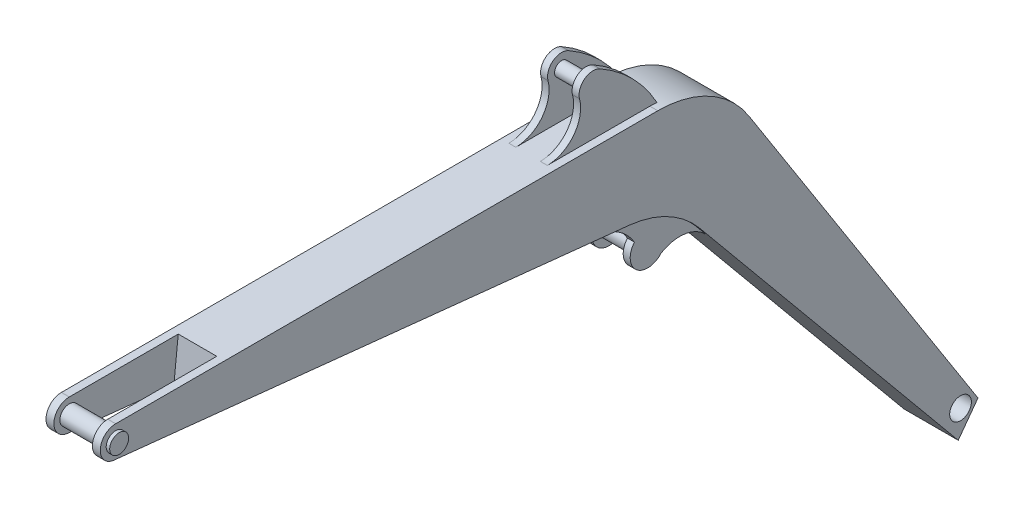
from build123d import *

# Parameters (mm, degrees)
SKETCH1_R           = 31
BOSS_EXTRUDE1_DEPTH = 77.5
CUT_EXTRUDE1_DEPTH  = 55
SKETCH3_R           = 27
BOSS_EXTRUDE2_DEPTH = 87.5
BOSS_EXTRUDE3_START = 55
SKETCH4_R           = 20
BOSS_EXTRUDE3_DEPTH = 20
BOSS_EXTRUDE4_START = 65
SKETCH5_R           = 28
BOSS_EXTRUDE4_DEPTH = 20
SKETCH6_R           = 20
BOSS_EXTRUDE5_DEPTH = 55
SKETCH7_R           = 28
BOSS_EXTRUDE6_DEPTH = 65


with BuildPart() as part:
    # Sketch1 → Boss-Extrude1 (new, symmetric)
    with BuildSketch(Plane(origin=(0, 0, 0), x_dir=(0, 0, -1), z_dir=(1, 0, 0))):
        with BuildLine():
            Line((-1649, 128.575159042), (-100.623018779, 128.575159042))
            ThreePointArc((-100.623018779, 128.575159042), (47.370818148, 90.689624097), (158.95669611, -13.646761532))
            Line((158.95669611, -13.646761532), (813.901849353, -1039.177258296))
            Line((813.901849353, -1039.177258296), (757.478946429, -1115.606676884))
            Line((757.478946429, -1115.606676884), (18.502038696, -221.191618301))
            ThreePointArc((18.502038696, -221.191618301), (-70.923814933, -147.926895035), (-181.413689889, -113.916742069))
            Line((-181.413689889, -113.916742069), (-1653.599252384, 40.816195646))
            ThreePointArc((-1653.599252384, 40.816195646), (-1692.939699529, 86.877941117), (-1649, 128.575159042))
        make_face()
        with Locations((764, -1039.424840958)):
            Circle(SKETCH1_R, mode=Mode.SUBTRACT)
    extrude(amount=BOSS_EXTRUDE1_DEPTH, both=True)

    # Sketch2 → Cut-Extrude1 (cut, symmetric)
    with BuildSketch(Plane(origin=(0, 0, 0), x_dir=(0, 0, -1), z_dir=(1, 0, 0))):
        with BuildLine():
            Line((-1337.780808047, 128.575159042), (-1350.221049377, 8.929861623))
            Line((-1350.221049377, 8.929861623), (-1653.599252384, 40.816195646))
            ThreePointArc((-1653.599252384, 40.816195646), (-1692.939699529, 86.877941117), (-1649, 128.575159042))
            Line((-1649, 128.575159042), (-1337.780808047, 128.575159042))
        make_face()
    extrude(amount=CUT_EXTRUDE1_DEPTH, both=True, mode=Mode.SUBTRACT)

    # Sketch3 → Boss-Extrude2 (add, symmetric)
    with BuildSketch(Plane(origin=(0, 0, 0), x_dir=(0, 0, -1), z_dir=(1, 0, 0))):
        with Locations((-1649, 84.575159042)):
            Circle(SKETCH3_R)
    extrude(amount=BOSS_EXTRUDE2_DEPTH, both=True)

    # Sketch4 → Boss-Extrude3 (add)
    with BuildSketch(Plane(origin=(0, 0, 0), x_dir=(0, 0, -1), z_dir=(1, 0, 0)).offset(BOSS_EXTRUDE3_START)):
        with BuildLine():
            Line((-100.623018779, 128.575159042), (-393.648383075, 128.575159042))
            ThreePointArc((-393.648383075, 128.575159042), (-318.488676572, 165.471643499), (-301.710632022, 247.501084968))
            ThreePointArc((-301.710632022, 247.501084968), (-287.401961188, 289.269705737), (-243.363225881, 292.423359888))
            ThreePointArc((-243.363225881, 292.423359888), (-150.511724148, 221.544648068), (-80.648383075, 127.926771904))
            ThreePointArc((-80.648383075, 127.926771904), (-90.630440565, 128.41301958), (-100.623018779, 128.575159042))
        make_face()
        with Locations((-263, 257.575159042)):
            Circle(SKETCH4_R, mode=Mode.SUBTRACT)
    extrude(amount=-BOSS_EXTRUDE3_DEPTH)

    # Mirror1: part across plane


with BuildPart() as part_1:
    add(part.part)
    add(part.part.mirror(Plane(origin=(0, 0, 0), x_dir=(0, 0, 1), z_dir=(1, 0, 0))))

    # Sketch5 → Boss-Extrude4 (add)
    with BuildSketch(Plane(origin=(0, 0, 0), x_dir=(0, 0, -1), z_dir=(1, 0, 0)).offset(BOSS_EXTRUDE4_START)):
        with BuildLine():
            Line((18.502038696, -221.191618301), (49.264592926, -258.424840958))
            ThreePointArc((49.264592926, -258.424840958), (-11.948195085, -227.059459611), (-79.255928514, -241.217905281))
            ThreePointArc((-79.255928514, -241.217905281), (-149.793064323, -246.168912443), (-154.744071486, -175.631776635))
            ThreePointArc((-154.744071486, -175.631776635), (-194.614118429, -131.834300288), (-248.329147356, -106.883644085))
            Line((-248.329147356, -106.883644085), (-181.413689889, -113.916742069))
            ThreePointArc((-181.413689889, -113.916742069), (-70.923814933, -147.926895035), (18.502038696, -221.191618301))
        make_face()
        with Locations((-117, -208.424840958)):
            Circle(SKETCH5_R, mode=Mode.SUBTRACT)
    extrude(amount=-BOSS_EXTRUDE4_DEPTH)

    # Mirror2: part across plane


with BuildPart() as part_2:
    add(part_1.part)
    add(part_1.part.mirror(Plane(origin=(0, 0, 0), x_dir=(0, 0, 1), z_dir=(1, 0, 0))))

    # Sketch6 → Boss-Extrude5 (add, symmetric)
    with BuildSketch(Plane(origin=(0, 0, 0), x_dir=(0, 0, -1), z_dir=(1, 0, 0))):
        with Locations((-263, 257.575159042)):
            Circle(SKETCH6_R)
    extrude(amount=BOSS_EXTRUDE5_DEPTH, both=True)

    # Sketch7 → Boss-Extrude6 (add, symmetric)
    with BuildSketch(Plane(origin=(0, 0, 0), x_dir=(0, 0, -1), z_dir=(1, 0, 0))):
        with Locations(Location((-117, -208.424840958, 0), (0, 0, 180))):
            Circle(SKETCH7_R)
    extrude(amount=BOSS_EXTRUDE6_DEPTH, both=True)


solid = part_2.part
